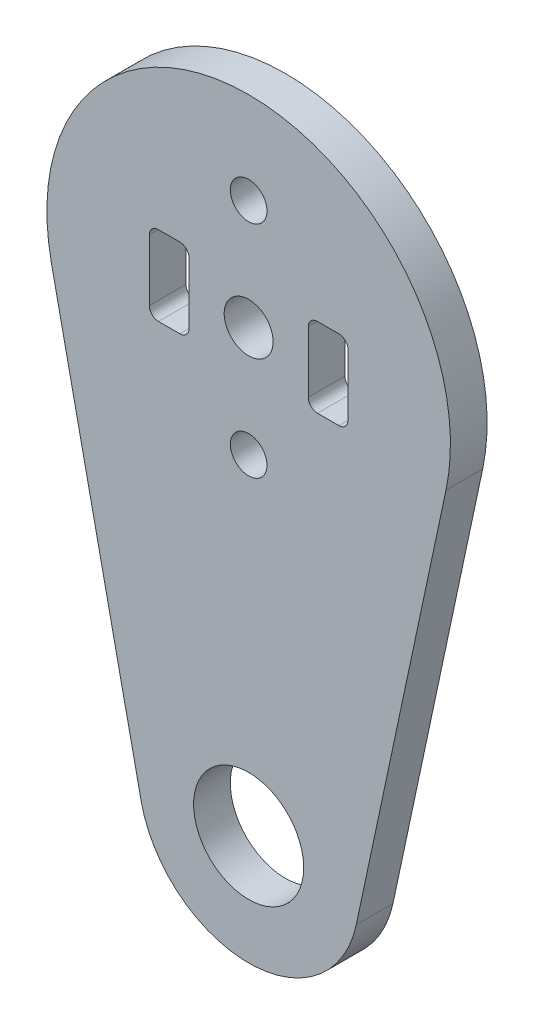
from build123d import *

# Parameters (mm, degrees)
MODEL_R                 = 2
MODEL_R_2               = 1.5
MODEL_R_3               = 4.5
SALIENTE_EXTRUIR1_DEPTH = 3


with BuildPart() as part:
    # Model → Saliente-Extruir1 (new body)
    with BuildSketch(Plane.XY):
        with BuildLine():
            Line((206.945286968, 204.077019993), (199.609852846, 238.514519993))
            ThreePointArc((199.609852846, 238.514519993), (215.747807914, 258.452019993), (231.885762981, 238.514519993))
            Line((231.885762981, 238.514519993), (224.550328859, 204.077019993))
            ThreePointArc((224.550328859, 204.077019993), (215.747807914, 196.952019993), (206.945286968, 204.077019993))
        make_face()
        with Locations((215.747807914, 241.952019993)):
            Circle(MODEL_R, mode=Mode.SUBTRACT)
        with Locations((215.747807914, 232.952019993)):
            Circle(MODEL_R_2, mode=Mode.SUBTRACT)
        with Locations((215.747807914, 250.952019993)):
            Circle(MODEL_R_2, mode=Mode.SUBTRACT)
        with Locations((215.747807914, 205.952019993)):
            Circle(MODEL_R_3, mode=Mode.SUBTRACT)
        with BuildLine():
            Line((223.122807913, 245.202019993), (221.372807913, 245.202019993))
            ThreePointArc((221.372807913, 245.202019993), (220.842477828, 244.982350079), (220.622807913, 244.452019993))
            Line((220.622807913, 244.452019993), (220.622807913, 239.452019993))
            ThreePointArc((220.622807913, 239.452019993), (220.842477828, 238.921689907), (221.372807913, 238.702019993))
            Line((221.372807913, 238.702019993), (223.122807913, 238.702019993))
            ThreePointArc((223.122807913, 238.702019993), (223.653137999, 238.921689907), (223.872807913, 239.452019993))
            Line((223.872807913, 239.452019993), (223.872807913, 244.452019993))
            ThreePointArc((223.872807913, 244.452019993), (223.653137999, 244.982350079), (223.122807913, 245.202019993))
        make_face(mode=Mode.SUBTRACT)
        with BuildLine():
            Line((208.372807913, 245.202019993), (210.122807913, 245.202019993))
            ThreePointArc((210.122807913, 245.202019993), (210.653137999, 244.982350079), (210.872807913, 244.452019993))
            Line((210.872807913, 244.452019993), (210.872807913, 239.452019993))
            ThreePointArc((210.872807913, 239.452019993), (210.653137999, 238.921689907), (210.122807913, 238.702019993))
            Line((210.122807913, 238.702019993), (208.372807913, 238.702019993))
            ThreePointArc((208.372807913, 238.702019993), (207.842477828, 238.921689907), (207.622807913, 239.452019993))
            Line((207.622807913, 239.452019993), (207.622807913, 244.452019993))
            ThreePointArc((207.622807913, 244.452019993), (207.842477828, 244.982350079), (208.372807913, 245.202019993))
        make_face(mode=Mode.SUBTRACT)
    extrude(amount=SALIENTE_EXTRUIR1_DEPTH)


solid = part.part
